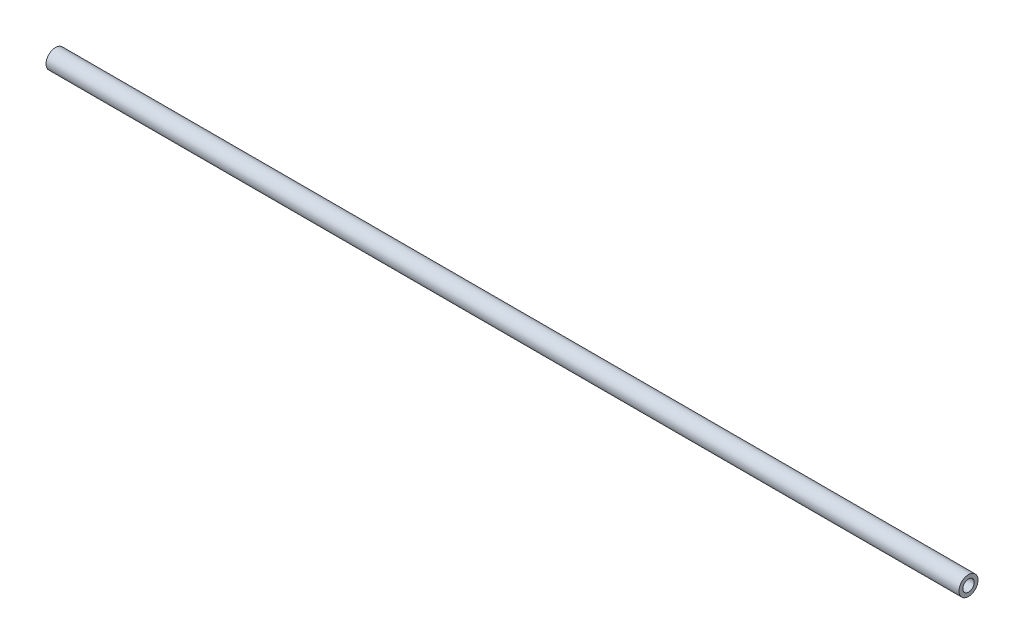
from build123d import *

# Parameters (mm, degrees)
SKETCH1_R      = 3.175
SKETCH1_R_2    = 1.905
EXTRUDE1_DEPTH = 152.4


with BuildPart() as part:
    # Sketch1 → Extrude1 (new, symmetric)
    with BuildSketch(Plane(origin=(0, 0, 0), x_dir=(0, 0, -1), z_dir=(1, 0, 0))):
        with Locations(Location((0, 0, 0), (0, 0, 180))):
            Circle(SKETCH1_R)
        with Locations(Location((0, 0, 0), (0, 0, 180))):
            Circle(SKETCH1_R_2, mode=Mode.SUBTRACT)
    extrude(amount=EXTRUDE1_DEPTH, both=True)


solid = part.part
